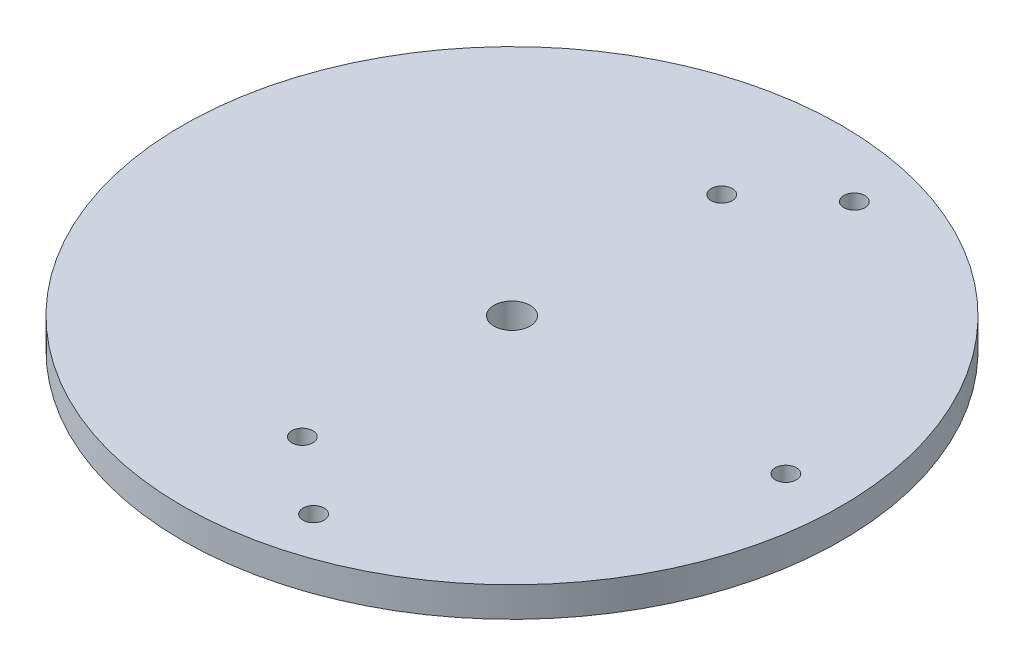
from build123d import *

# Parameters (mm, degrees)
SKETCH1_R           = 69.85
BOSS_EXTRUDE1_DEPTH = 6.35
SKETCH5_R           = 2.238375
SKETCH5_R_2         = 3.825875
CUT_EXTRUDE3_DEPTH  = 12.7


with BuildPart() as part:
    # Sketch1 → Boss-Extrude1 (new body)
    with BuildSketch(Plane(origin=(0, 0, 0), x_dir=(1, 0, 0), z_dir=(0, 1, 0))):
        with Locations(Location((-16.072515175, 12.054386381, 0), (0, 0, 270))):
            Circle(SKETCH1_R)
    extrude(amount=BOSS_EXTRUDE1_DEPTH)

    # Sketch5 → Cut-Extrude3 (cut)
    with BuildSketch(Plane(origin=(0, 6.35, 0), x_dir=(1, 0, 0), z_dir=(0, 1, 0))):
        with Locations(Location((-0.738778166, 69.280671968, 0), (0, 0, 270))):
            Circle(SKETCH5_R)
        with Locations(Location((-16.072515175, 56.504386381, 0), (0, 0, 270))):
            Circle(SKETCH5_R)
        with Locations(Location((-16.072515175, 12.054386381, 0), (0, 0, 270))):
            Circle(SKETCH5_R_2)
        with Locations(Location((-16.072515175, -32.395613619, 0), (0, 0, 270))):
            Circle(SKETCH5_R)
        with Locations(Location((-0.679642183, -45.392597698, 0), (0, 0, 270))):
            Circle(SKETCH5_R)
        with Locations(Location((41.966484825, 12.054386381, 0), (0, 0, 270))):
            Circle(SKETCH5_R)
    extrude(amount=-CUT_EXTRUDE3_DEPTH, mode=Mode.SUBTRACT)


solid = part.part
